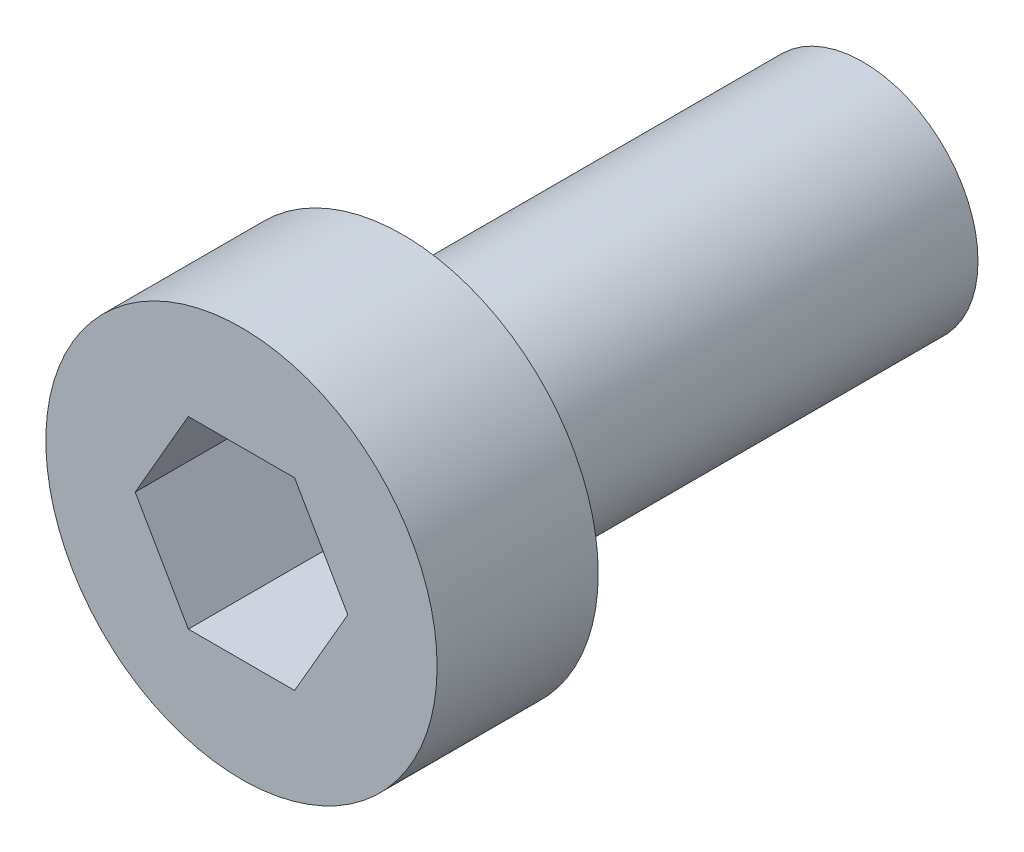
from build123d import *

# Parameters (mm, degrees)
ESQUISSE1_R             = 2.5
BOSS_EXTRU_1_DEPTH      = 10
ESQUISSE2_R             = 4.25
BOSS_EXTRU_2_DEPTH      = 3.5
ENL_V_MAT_EXTRU_1_DEPTH = 3.5


with BuildPart() as part:
    # Esquisse1 → Boss.-Extru.1 (new body)
    with BuildSketch(Plane.XY):
        Circle(ESQUISSE1_R)
    extrude(amount=BOSS_EXTRU_1_DEPTH)

    # Esquisse2 → Boss.-Extru.2 (add)
    with BuildSketch(Plane.XY.offset(10)):
        Circle(ESQUISSE2_R)
    extrude(amount=BOSS_EXTRU_2_DEPTH)

    # Esquisse3 → Enlèv. mat.-Extru.1 (cut)
    with BuildSketch(Plane.XY.offset(13.5)):
        Polygon((2.309401077, 0), (1.154700538, 2), (-1.154700538, 2), (-2.309401077, 0), (-1.154700538, -2), (1.154700538, -2), align=None)
    extrude(amount=-ENL_V_MAT_EXTRU_1_DEPTH, mode=Mode.SUBTRACT)


solid = part.part
